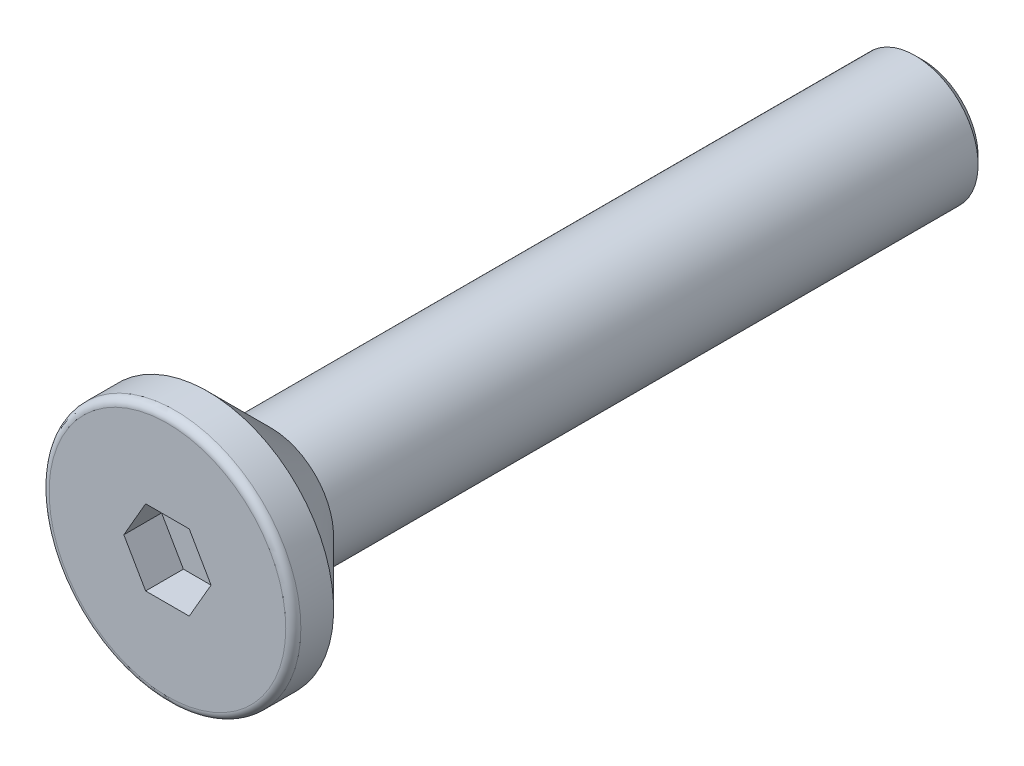
from build123d import *

# Parameters (mm, degrees)
CUT_EXTRUDE_1_DEPTH = 1.5
FILLET_1_R          = 0.3


with BuildPart() as part:
    # 草图1 → 旋转1 (revolve)
    with BuildSketch(Plane(origin=(0, 0, 0), x_dir=(0, 0, -1), z_dir=(1, 0, 0)), mode=Mode.PRIVATE) as revolve_1_sk:
        Polygon((-15, 0), (-15, 5), (-13.4, 5), (-10.9, 2.5), (14.7, 2.5), (15, 2.2), (15, 0), align=None)
    revolve(revolve_1_sk.sketch.rotate(Axis((0, 0, -15), (0, 0, 1)), 90), axis=Axis((0, 0, -15), (0, 0, 1)))

    # 草图2 → 切除-拉伸1 (cut)
    with BuildSketch(Plane.XY.offset(15)):
        Polygon((1.732050808, 0), (0.866025404, 1.5), (-0.866025404, 1.5), (-1.732050808, 0), (-0.866025404, -1.5), (0.866025404, -1.5), align=None)
    extrude(amount=-CUT_EXTRUDE_1_DEPTH, mode=Mode.SUBTRACT)

    # 圆角1
    fillet_1_edges = [part.edges().sort_by_distance(p)[0] for p in [
        (5, 0, 15),
    ]]
    fillet(fillet_1_edges, radius=FILLET_1_R)


solid = part.part
